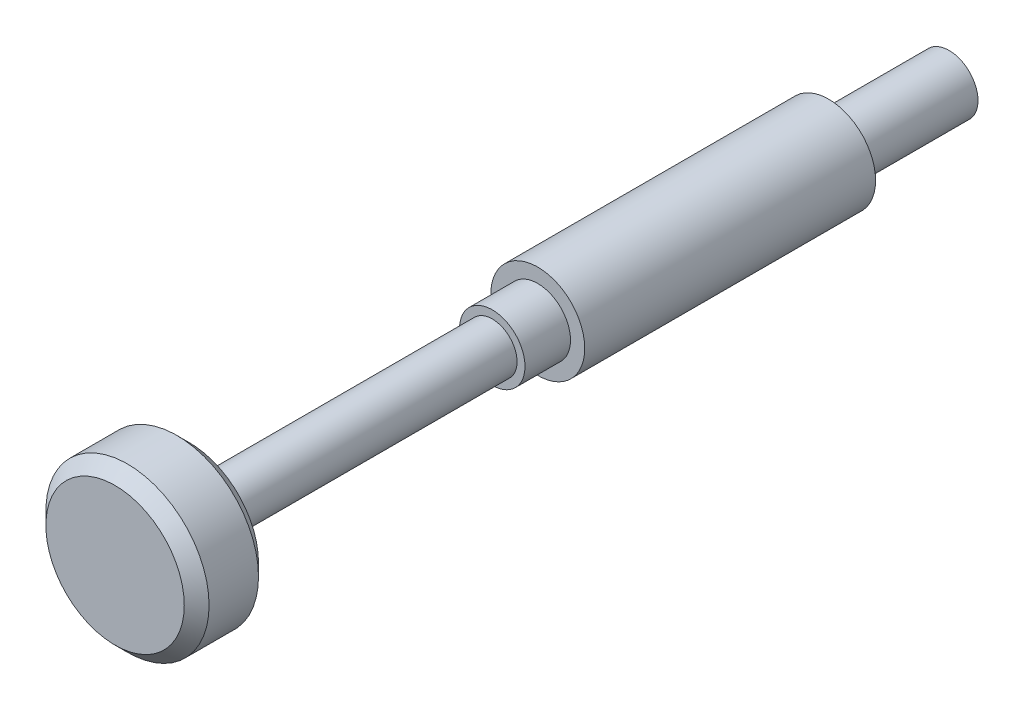
from build123d import *

# Parameters (mm, degrees)
SKETCH1_R           = 3.5
BOSS_EXTRUDE1_DEPTH = 14.55
SKETCH2_R           = 5.675
BOSS_EXTRUDE2_DEPTH = 35.14
SKETCH3_R           = 3.955
BOSS_EXTRUDE3_DEPTH = 5.5
SKETCH4_R           = 3
BOSS_EXTRUDE4_DEPTH = 36.6
SKETCH5_R           = 9.86
BOSS_EXTRUDE5_DEPTH = 8.97
CHAMFER1_SIZE       = 1.5


with BuildPart() as part:
    # Sketch1 → Boss-Extrude1 (new body)
    with BuildSketch(Plane.XY):
        Circle(SKETCH1_R)
    extrude(amount=BOSS_EXTRUDE1_DEPTH)

    # Sketch2 → Boss-Extrude2 (add)
    with BuildSketch(Plane.XY.offset(14.55)):
        Circle(SKETCH2_R)
    extrude(amount=BOSS_EXTRUDE2_DEPTH)

    # Sketch3 → Boss-Extrude3 (add)
    with BuildSketch(Plane.XY.offset(49.69)):
        Circle(SKETCH3_R)
    extrude(amount=BOSS_EXTRUDE3_DEPTH)

    # Sketch4 → Boss-Extrude4 (add)
    with BuildSketch(Plane.XY.offset(55.19)):
        Circle(SKETCH4_R)
    extrude(amount=BOSS_EXTRUDE4_DEPTH)

    # Sketch5 → Boss-Extrude5 (add)
    with BuildSketch(Plane.XY.offset(91.79)):
        Circle(SKETCH5_R)
    extrude(amount=BOSS_EXTRUDE5_DEPTH)

    # Chamfer1
    chamfer1_edges = [part.edges().sort_by_distance(p)[0] for p in [
        (-9.86, 0, 91.79),
        (-9.86, 0, 100.76),
    ]]
    chamfer(chamfer1_edges, length=CHAMFER1_SIZE)


solid = part.part
